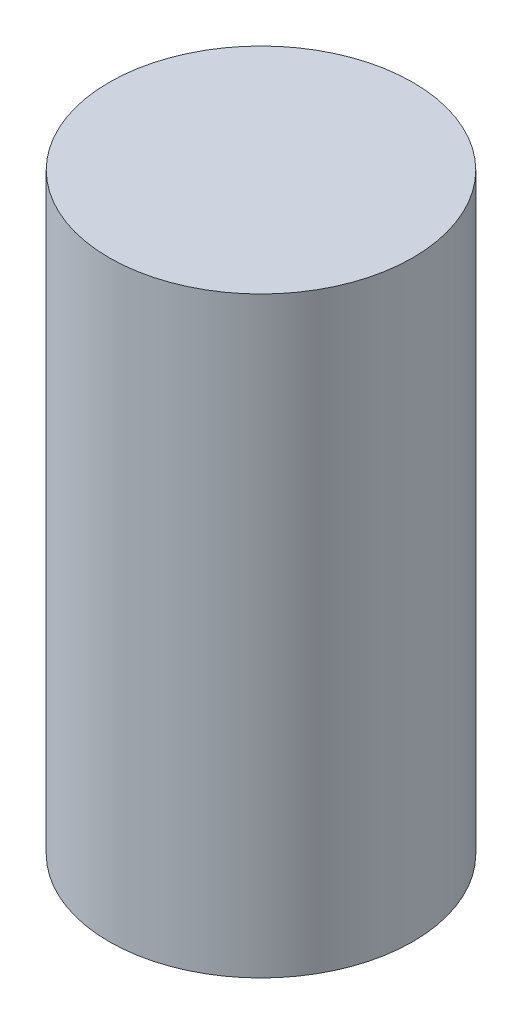
from build123d import *

# Parameters (mm, degrees)
SKETCH1_R           = 2.54
BOSS_EXTRUDE1_DEPTH = 9.906


with BuildPart() as part:
    # Sketch1 → Boss-Extrude1 (new body)
    with BuildSketch(Plane(origin=(0, 0, 0), x_dir=(1, 0, 0), z_dir=(0, 1, 0))):
        with Locations(Location((0, 0, 0), (0, 0, 270))):
            Circle(SKETCH1_R)
    extrude(amount=BOSS_EXTRUDE1_DEPTH)


solid = part.part
